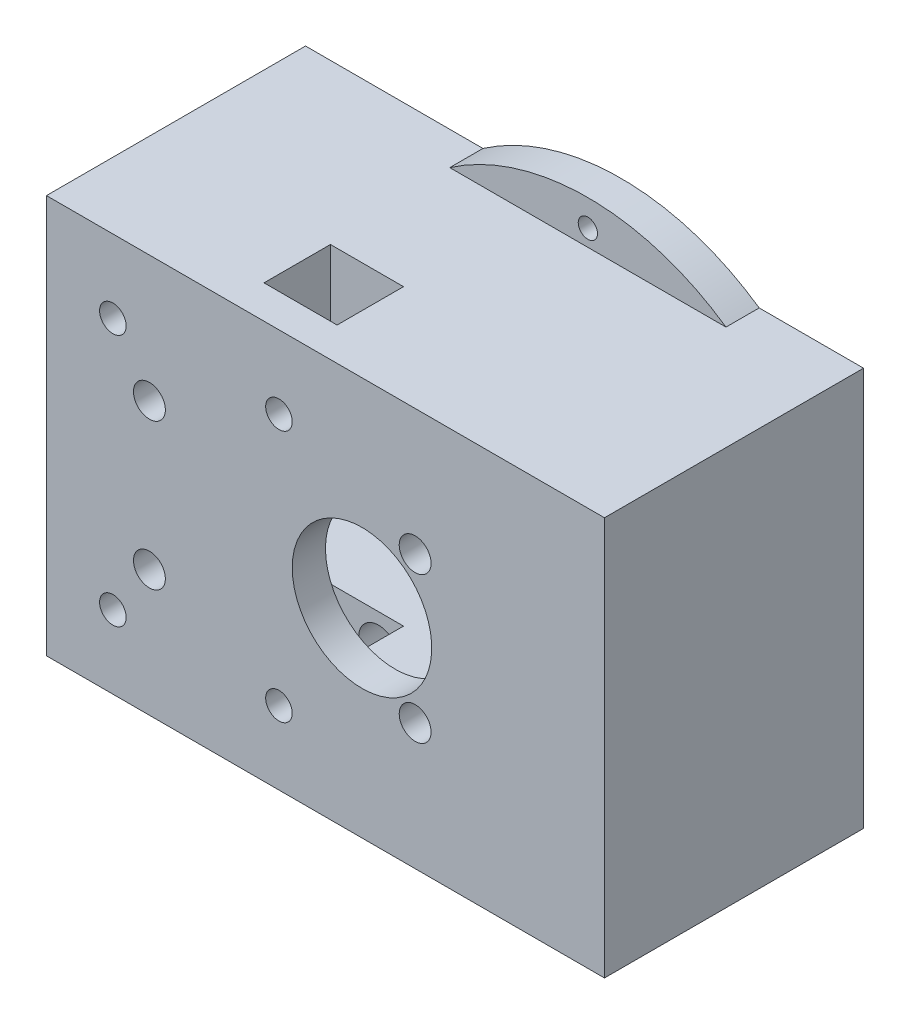
from build123d import *

# Parameters (mm, degrees)
SKETCH_1_W               = 84
SKETCH_1_H               = 60
EXTRUDE_1_DEPTH          = 39
SKETCH_3_R               = 36.5
EXTRUDE_2_DEPTH          = 5
SKETCH_4_R               = 1.45
CUT_EXTRUDE_2_DEPTH      = 5
PATTERN_CIRCULAR_1_COUNT = 8
SKETCH_2_W               = 58.75
SKETCH_2_H               = 28.5
CUT_EXTRUDE_1_DEPTH      = 34
SKETCH_6_R               = 10.5
SKETCH_6_R_2             = 2.4
CUT_EXTRUDE_3_DEPTH      = 5
SKETCH_7_R               = 2
CUT_EXTRUDE_4_DEPTH      = 40
SKETCH_8_R               = 3
CUT_EXTRUDE_5_DEPTH      = 34
SKETCH_9_W               = 11
SKETCH_9_H               = 10
CUT_EXTRUDE_6_DEPTH      = 100


with BuildPart() as part:
    # 草图1 → 凸台-拉伸1 (new body)
    with BuildSketch(Plane.XY):
        with Locations((8.550148957, -9.437934459)):
            Rectangle(SKETCH_1_W, SKETCH_1_H)
    extrude(amount=EXTRUDE_1_DEPTH)

    # 草图3 → 凸台-拉伸2 (add)
    with BuildSketch(Plane(origin=(0, 0, 0), x_dir=(-1, 0, 0), z_dir=(0, 0, -1))):
        with Locations((-14.050148957, -9.437934459)):
            Circle(SKETCH_3_R)
    extrude(amount=-EXTRUDE_2_DEPTH)

    # 草图4 → 切除-拉伸2 (cut)
    with BuildSketch(Plane(origin=(0, 0, 0), x_dir=(-1, 0, 0), z_dir=(0, 0, -1))):
        with Locations((-46.550148957, -9.437934459)):
            Circle(SKETCH_4_R)
    cut_extrude_2 = extrude(amount=-CUT_EXTRUDE_2_DEPTH, mode=Mode.SUBTRACT)

    # 阵列(圆周)1: 切除-拉伸2 ×8 about axis
    pattern_circular_1_axis = Axis((14.050148957, -9.437934459, 0), (0, 0, 1))
    for i in range(1, PATTERN_CIRCULAR_1_COUNT):
        add(cut_extrude_2.rotate(pattern_circular_1_axis, i * 360 / PATTERN_CIRCULAR_1_COUNT), mode=Mode.SUBTRACT)

    # 草图2 → 切除-拉伸1 (cut)
    with BuildSketch(Plane(origin=(0, 0, 0), x_dir=(-1, 0, 0), z_dir=(0, 0, -1))):
        with Locations((4.074851043, -9.437934459)):
            Rectangle(SKETCH_2_W, SKETCH_2_H)
    extrude(amount=-CUT_EXTRUDE_1_DEPTH, mode=Mode.SUBTRACT)

    # 草图6 → 切除-拉伸3 (cut)
    with BuildSketch(Plane(origin=(0, 0, 34), x_dir=(-1, 0, 0), z_dir=(0, 0, -1))):
        with Locations((-14.050148957, -9.437934459)):
            Circle(SKETCH_6_R)
        with Locations((-22.050148957, 1.562065541)):
            Circle(SKETCH_6_R_2)
        with Locations((-22.050148957, -20.437934459)):
            Circle(SKETCH_6_R_2)
        with Locations((17.949851043, -20.437934459)):
            Circle(SKETCH_6_R_2)
        with Locations((17.949851043, 1.562065541)):
            Circle(SKETCH_6_R_2)
    extrude(amount=-CUT_EXTRUDE_3_DEPTH, mode=Mode.SUBTRACT)

    # 草图7 → 切除-拉伸4 (cut)
    with BuildSketch(Plane.XY.offset(39)):
        with Locations((-23.449851043, 9.562065541)):
            Circle(SKETCH_7_R)
        with Locations((-23.449851043, -28.437934459)):
            Circle(SKETCH_7_R)
        with Locations((1.550148957, 9.562065541)):
            Circle(SKETCH_7_R)
        with Locations((1.550148957, -28.437934459)):
            Circle(SKETCH_7_R)
    extrude(amount=-CUT_EXTRUDE_4_DEPTH, mode=Mode.SUBTRACT)

    # 草图8 → 切除-拉伸5 (cut)
    with BuildSketch(Plane(origin=(0, 0, 0), x_dir=(-1, 0, 0), z_dir=(0, 0, -1))):
        with Locations((-1.550148957, 9.562065541)):
            Circle(SKETCH_8_R)
        with Locations((23.449851043, 9.562065541)):
            Circle(SKETCH_8_R)
        with Locations((-1.550148957, -28.437934459)):
            Circle(SKETCH_8_R)
        with Locations((23.449851043, -28.437934459)):
            Circle(SKETCH_8_R)
    extrude(amount=-CUT_EXTRUDE_5_DEPTH, mode=Mode.SUBTRACT)

    # 草图9 → 切除-拉伸6 (cut)
    with BuildSketch(Plane(origin=(0, -39.437934459, 0), x_dir=(-1, 0, 0), z_dir=(0, -1, 0))):
        with Locations((0.199851043, -29)):
            Rectangle(SKETCH_9_W, SKETCH_9_H)
    extrude(amount=-CUT_EXTRUDE_6_DEPTH, mode=Mode.SUBTRACT)


solid = part.part
